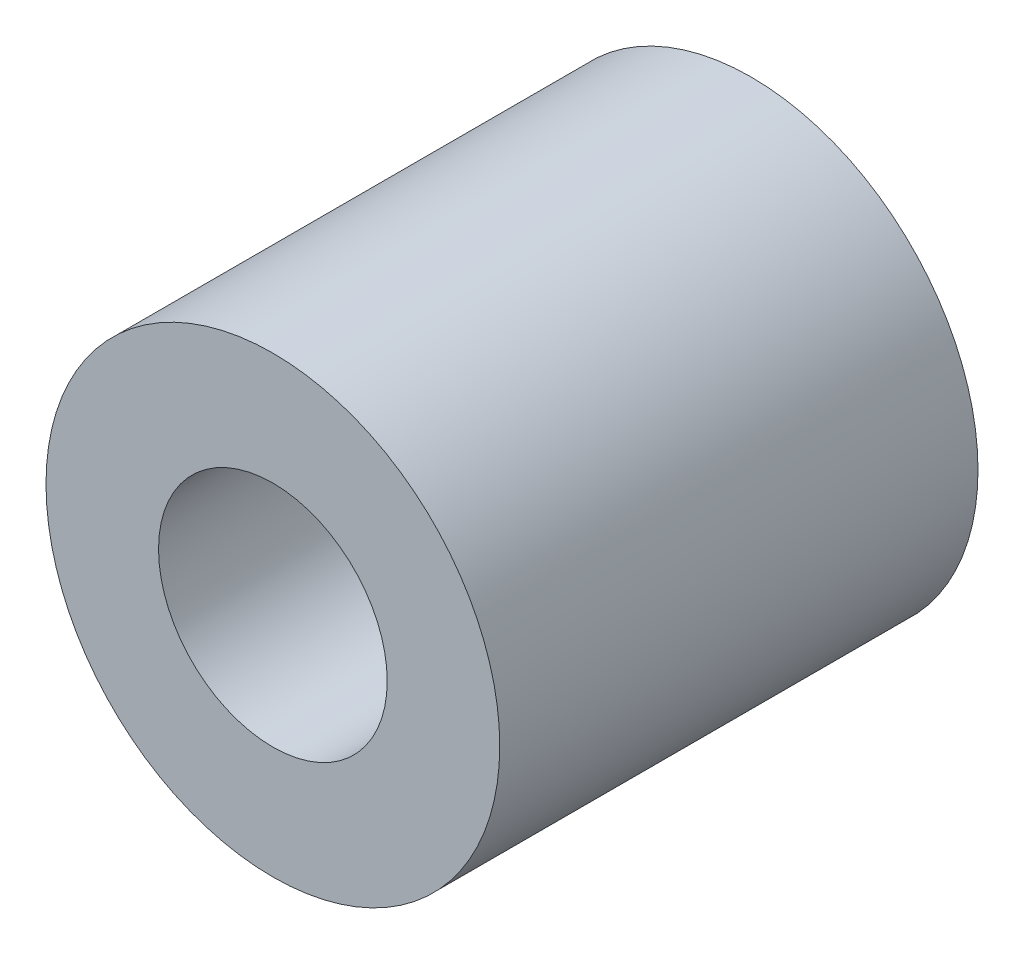
from build123d import *

# Parameters (mm, degrees)
SKETCH1_R      = 6.35
SKETCH1_R_2    = 3.2004
EXTRUDE1_DEPTH = 6.6929


with BuildPart() as part:
    # Sketch1 → Extrude1 (new, symmetric)
    with BuildSketch(Plane.XY):
        Circle(SKETCH1_R)
        Circle(SKETCH1_R_2, mode=Mode.SUBTRACT)
    extrude(amount=EXTRUDE1_DEPTH, both=True)


solid = part.part
